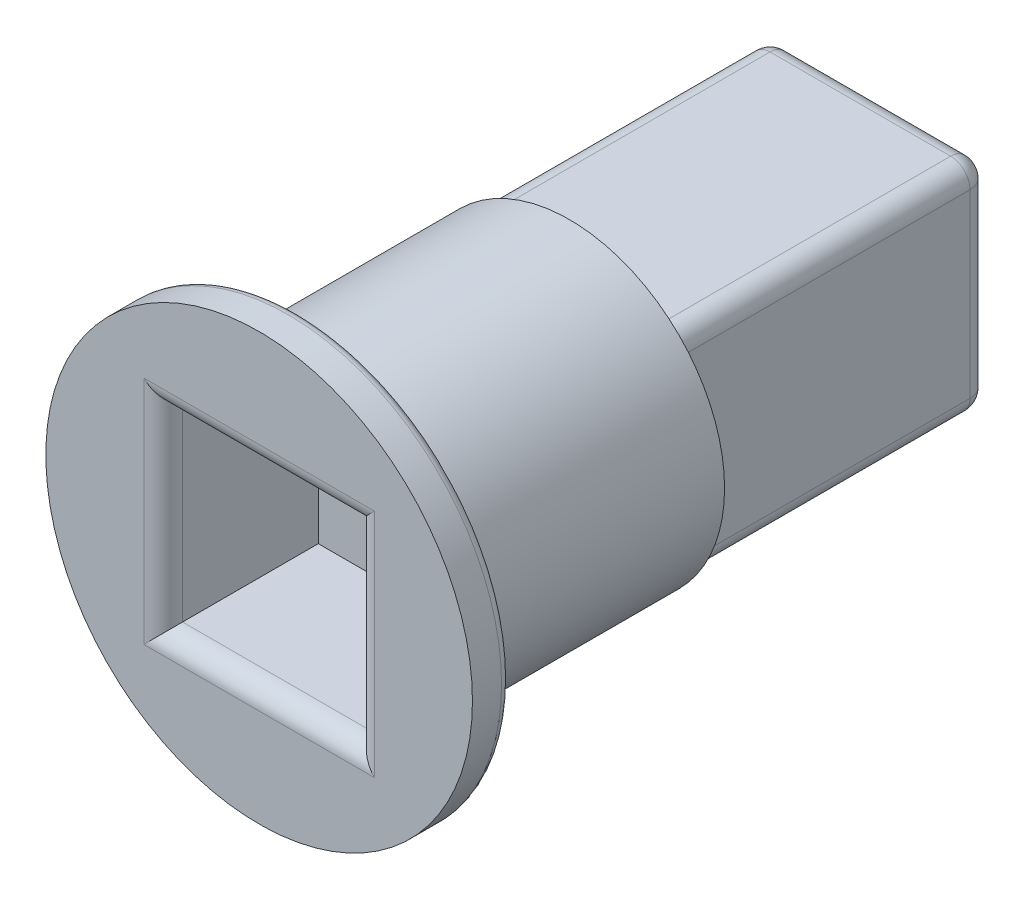
from build123d import *

# Parameters (mm, degrees)
ESQUISSE1_R      = 4
EXTRUSION1_DEPTH = 7
ESQUISSE3_W      = 5.65685425
ESQUISSE3_H      = 5.65685425
EXTRUSION3_DEPTH = 8
CONG_4_R         = 0.5
ESQUISSE7_R      = 5.5
EXTRUSION6_DEPTH = 1
ESQUISSE8_R      = 1.5
EXTRUSION7_DEPTH = 18.790446875
ESQUISSE9_W      = 4.949747468
ESQUISSE9_H      = 4.949747468
EXTRUSION8_DEPTH = 4
CONG_5_R         = 0.25
CONG_6_R         = 0.5


with BuildPart() as part:
    # Esquisse1 → Extrusion1 (new body)
    with BuildSketch(Plane.XY):
        Circle(ESQUISSE1_R)
    extrude(amount=-EXTRUSION1_DEPTH)

    # Esquisse3 → Extrusion3 (add)
    with BuildSketch(Plane(origin=(0, 0, -7), x_dir=(-1, 0, 0), z_dir=(0, 0, -1))):
        Rectangle(ESQUISSE3_W, ESQUISSE3_H)
    extrude(amount=EXTRUSION3_DEPTH)

    # Congé4
    cong_4_edges = [part.edges().sort_by_distance(p)[0] for p in [
        (-2.828427125, 0, -15),
        (0, 2.828427125, -15),
        (2.828427125, 2.828427125, -11),
        (2.828427125, -2.828427125, -11),
        (-2.828427125, -2.828427125, -11),
        (-2.828427125, 2.828427125, -11),
        (2.828427125, 0, -15),
        (0, -2.828427125, -15),
    ]]
    fillet(cong_4_edges, radius=CONG_4_R)

    # Esquisse7 → Extrusion6 (add)
    with BuildSketch(Plane.XY):
        Circle(ESQUISSE7_R)
    extrude(amount=EXTRUSION6_DEPTH)

    # Esquisse8 → Extrusion7 (cut, through all)
    with BuildSketch(Plane.XY.offset(1)):
        Circle(ESQUISSE8_R)
    extrude(amount=-EXTRUSION7_DEPTH, mode=Mode.SUBTRACT)

    # Esquisse9 → Extrusion8 (cut)
    with BuildSketch(Plane.XY.offset(1)):
        Rectangle(ESQUISSE9_W, ESQUISSE9_H)
    extrude(amount=-EXTRUSION8_DEPTH, mode=Mode.SUBTRACT)

    # Congé5
    cong_5_edges = [part.edges().sort_by_distance(p)[0] for p in [
        (-5.5, 0, 0),
    ]]
    fillet(cong_5_edges, radius=CONG_5_R)

    # Congé6
    cong_6_edges = [part.edges().sort_by_distance(p)[0] for p in [
        (-2.474873734, 0, 1),
        (0, -2.474873734, 1),
        (2.474873734, 0, 1),
        (0, 2.474873734, 1),
    ]]
    fillet(cong_6_edges, radius=CONG_6_R)


solid = part.part
